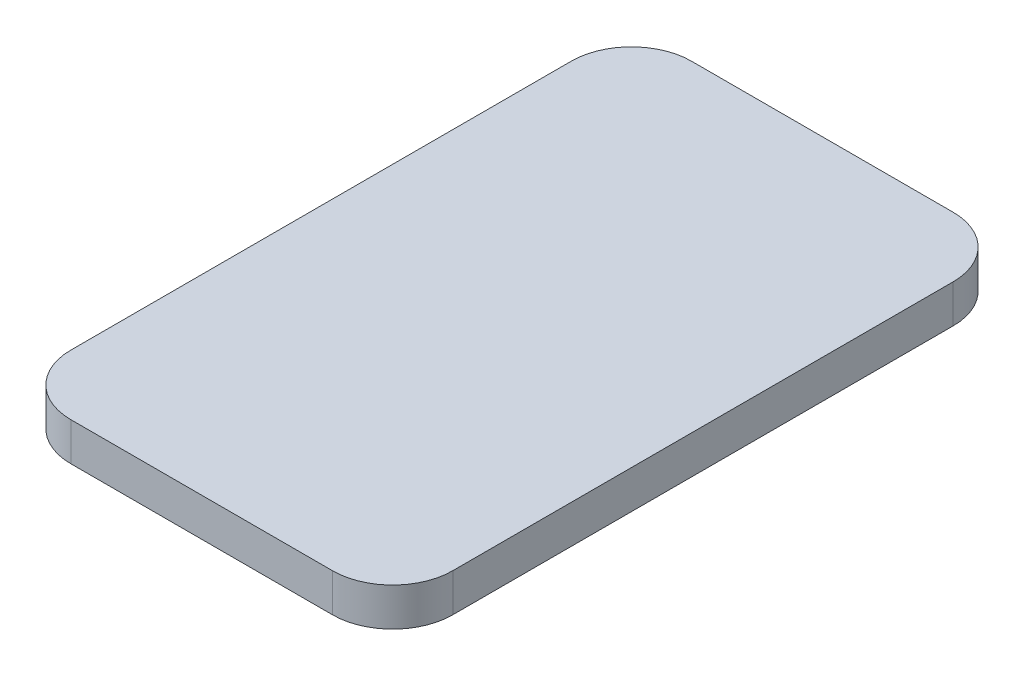
from build123d import *

# Parameters (mm, degrees)
AUFSATZ_LINEAR_AUSTRAGEN1_DEPTH = 8


with BuildPart() as part:
    # Skizze1 → Aufsatz-Linear austragen1 (new body)
    with BuildSketch(Plane(origin=(0, 0, 0), x_dir=(1, 0, 0), z_dir=(0, 1, 0))):
        with BuildLine():
            Line((-27.4, -65), (27.4, -65))
            ThreePointArc((27.4, -65), (36.309545443, -61.309545443), (40, -52.4))
            Line((40, -52.4), (40, 52.4))
            ThreePointArc((40, 52.4), (36.309545443, 61.309545443), (27.4, 65))
            Line((27.4, 65), (-27.4, 65))
            ThreePointArc((-27.4, 65), (-36.309545443, 61.309545443), (-40, 52.4))
            Line((-40, 52.4), (-40, -52.4))
            ThreePointArc((-40, -52.4), (-36.309545443, -61.309545443), (-27.4, -65))
        make_face()
    extrude(amount=AUFSATZ_LINEAR_AUSTRAGEN1_DEPTH)


solid = part.part
